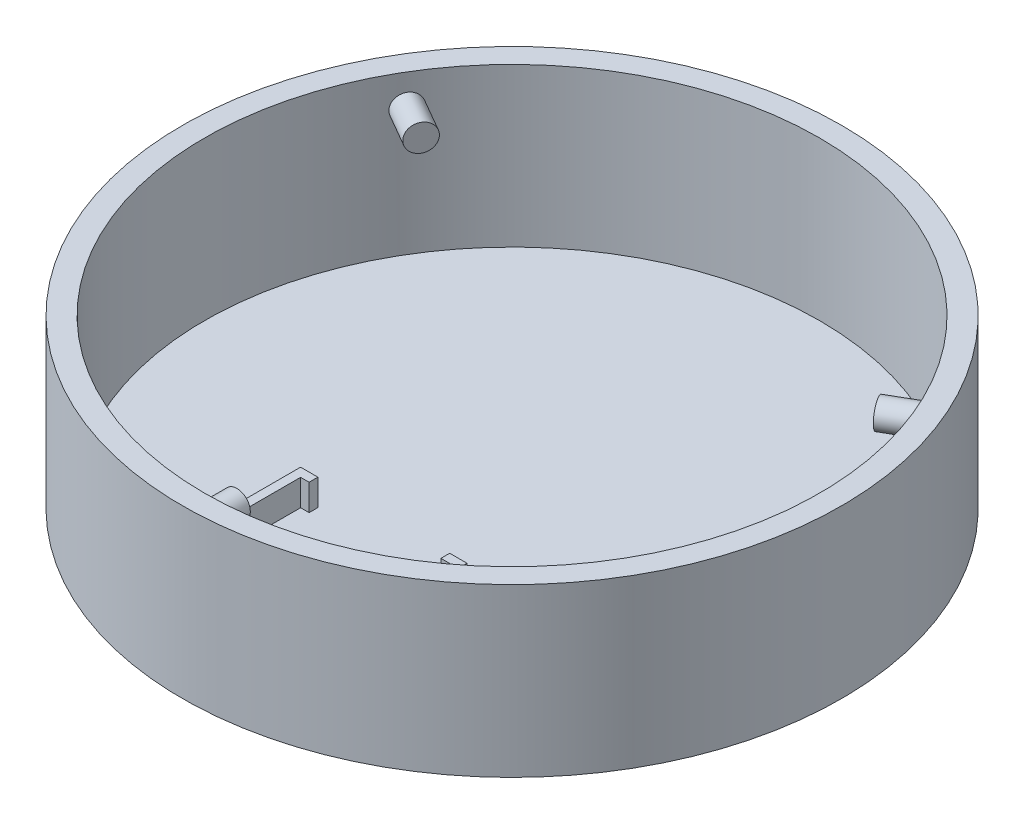
from build123d import *

# Parameters (mm, degrees)
SKETCH1_R           = 95.25
BOSS_EXTRUDE1_DEPTH = 48.26
SKETCH2_R           = 88.9
CUT_EXTRUDE1_DEPTH  = 45.72
SKETCH3_R           = 3.875
BOSS_EXTRUDE4_DEPTH = 11
CIRPATTERN1_COUNT   = 3
SKETCH8_W           = 48.096
SKETCH8_H           = 48.096
SKETCH8_W_2         = 43.016
SKETCH8_H_2         = 43.016
BOSS_EXTRUDE5_DEPTH = 7.62
SKETCH11_W          = 38.096
SKETCH11_H          = 7.62
CUT_EXTRUDE2_DEPTH  = 2.54


with BuildPart() as part:
    # Sketch1 → Boss-Extrude1 (new body)
    with BuildSketch(Plane(origin=(0, 0, 0), x_dir=(1, 0, 0), z_dir=(0, 1, 0))):
        with Locations(Location((0, 0, 0), (0, 0, 90))):
            Circle(SKETCH1_R)
    extrude(amount=BOSS_EXTRUDE1_DEPTH)

    # Sketch2 → Cut-Extrude1 (cut)
    with BuildSketch(Plane(origin=(0, 48.26, 0), x_dir=(1, 0, 0), z_dir=(0, 1, 0))):
        with Locations(Location((0, 0, 0), (0, 0, 270))):
            Circle(SKETCH2_R)
    extrude(amount=-CUT_EXTRUDE1_DEPTH, mode=Mode.SUBTRACT)

    # Sketch3 → Boss-Extrude4 (add)
    with BuildSketch(Plane(origin=(0, 0, 88.9), x_dir=(-1, 0, 0), z_dir=(0, 0, -1))):
        with Locations((1.626800498, 39.26)):
            Circle(SKETCH3_R)
    boss_extrude4 = extrude(amount=BOSS_EXTRUDE4_DEPTH)

    # CirPattern1: Boss-Extrude4 ×3 about axis
    cirpattern1_axis = Axis((0, 0, 0), (0, 1, 0))
    for i in range(1, CIRPATTERN1_COUNT):
        add(boss_extrude4.rotate(cirpattern1_axis, i * 360 / CIRPATTERN1_COUNT))

    # Sketch8 → Boss-Extrude5 (add)
    with BuildSketch(Plane(origin=(0, 2.54, 0), x_dir=(1, 0, 0), z_dir=(0, 1, 0))):
        with Locations((-6.666911053, -54.455125388)):
            Rectangle(SKETCH8_W, SKETCH8_H)
        with Locations((-6.666911053, -54.455125388)):
            Rectangle(SKETCH8_W_2, SKETCH8_H_2, mode=Mode.SUBTRACT)
    extrude(amount=BOSS_EXTRUDE5_DEPTH)

    # Sketch11 → Cut-Extrude2 (cut)
    with BuildSketch(Plane(origin=(0, 0, 30.407125388), x_dir=(-1, 0, 0), z_dir=(0, 0, -1))):
        with Locations((6.666911053, 6.35)):
            Rectangle(SKETCH11_W, SKETCH11_H)
    extrude(amount=-CUT_EXTRUDE2_DEPTH, mode=Mode.SUBTRACT)


solid = part.part
